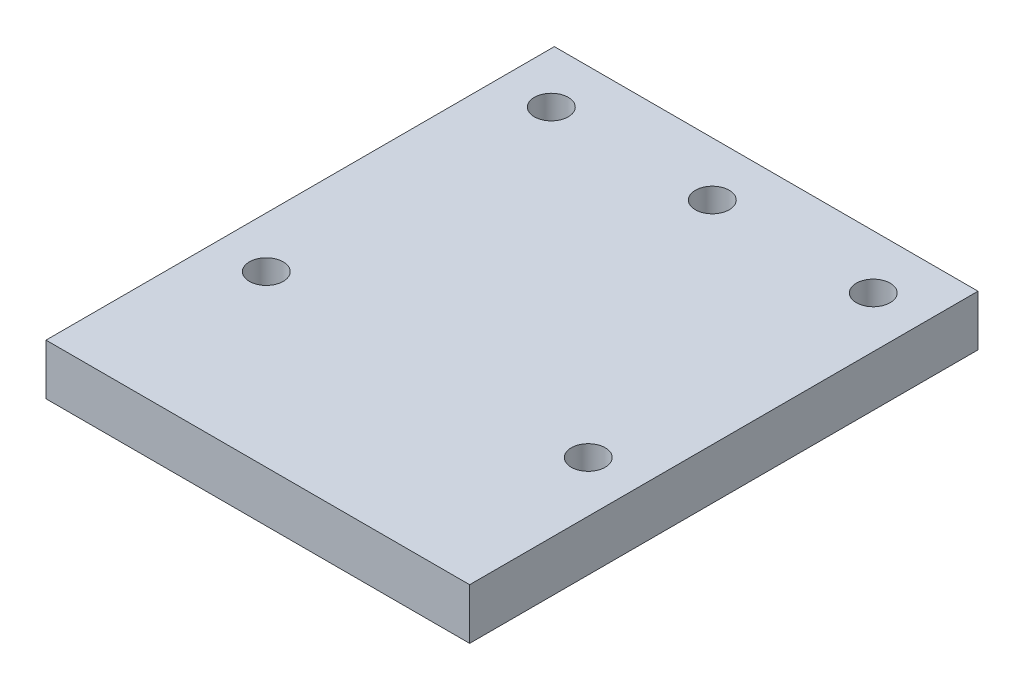
from build123d import *

# Parameters (mm, degrees)
SKETCH1_W           = 25
SKETCH1_H           = 30
SKETCH1_R           = 1
BOSS_EXTRUDE1_DEPTH = 3


with BuildPart() as part:
    # Sketch1 → Boss-Extrude1 (new body)
    with BuildSketch(Plane(origin=(0, 0, 0), x_dir=(1, 0, 0), z_dir=(0, 1, 0))):
        with Locations((12.5, -15)):
            Rectangle(SKETCH1_W, SKETCH1_H)
        with Locations(Location((12.5, -3.18, 0), (0, 0, 270))):
            Circle(SKETCH1_R, mode=Mode.SUBTRACT)
        with Locations(Location((3, -20, 0), (0, 0, 270))):
            Circle(SKETCH1_R, mode=Mode.SUBTRACT)
        with Locations(Location((22, -20, 0), (0, 0, 270))):
            Circle(SKETCH1_R, mode=Mode.SUBTRACT)
        with Locations(Location((22, -3.18, 0), (0, 0, 270))):
            Circle(SKETCH1_R, mode=Mode.SUBTRACT)
        with Locations(Location((3, -3.18, 0), (0, 0, 270))):
            Circle(SKETCH1_R, mode=Mode.SUBTRACT)
    extrude(amount=BOSS_EXTRUDE1_DEPTH)


solid = part.part
